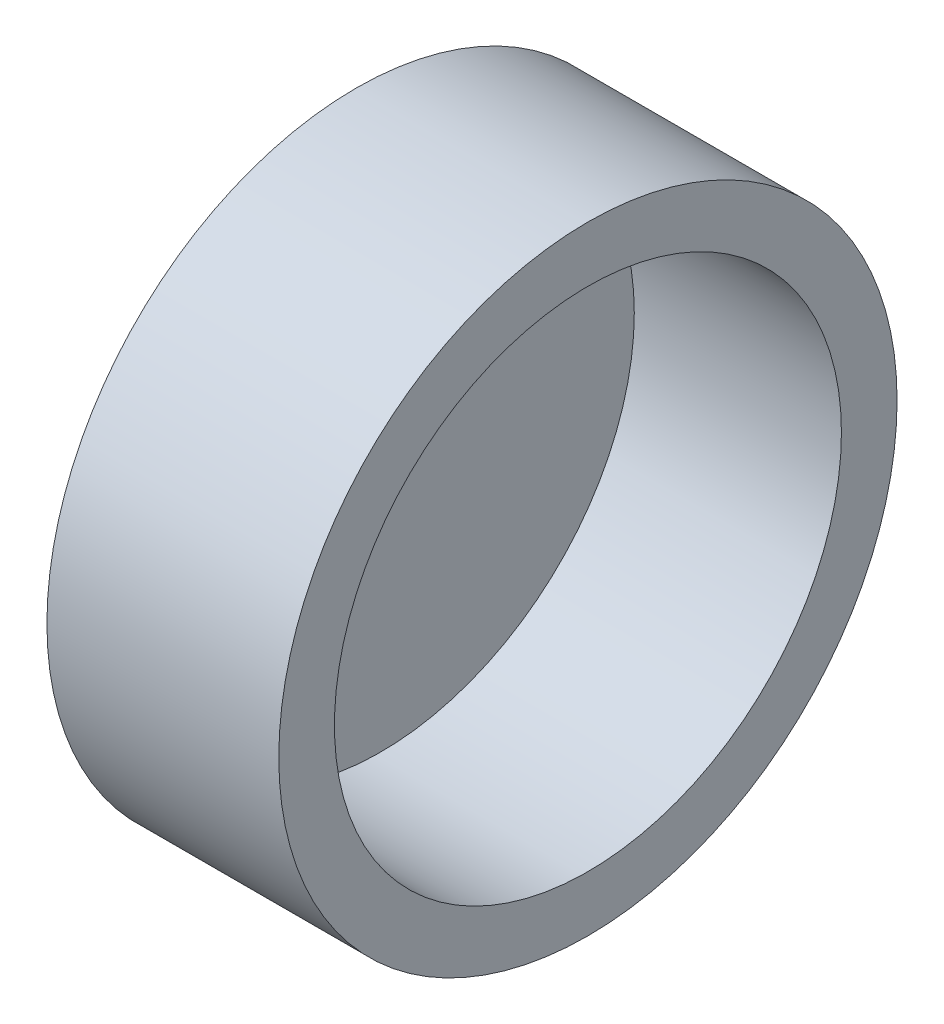
from build123d import *

# Parameters (mm, degrees)
SKETCH1_R                    = 164
ROTOR_VOLUME_EXTRUDE_DEPTH   = 16
SKETCH2_R                    = 200
SKETCH2_R_2                  = 164
DUCT_PACKAGING_EXTRUDE_DEPTH = 150


with BuildPart() as part:
    # Sketch1 → Rotor_Volume_Extrude (new, symmetric)
    with BuildSketch(Plane(origin=(0, 0, 0), x_dir=(0, 0, -1), z_dir=(1, 0, 0))):
        Circle(SKETCH1_R)
    extrude(amount=ROTOR_VOLUME_EXTRUDE_DEPTH, both=True)


with BuildPart() as body_2:
    # Sketch2 → Duct_Packaging_Extrude (new body)
    with BuildSketch(Plane(origin=(0, 0, 0), x_dir=(0, 0, -1), z_dir=(1, 0, 0))):
        Circle(SKETCH2_R)
        Circle(SKETCH2_R_2, mode=Mode.SUBTRACT)
    extrude(amount=DUCT_PACKAGING_EXTRUDE_DEPTH)


solid = Compound([part.part, body_2.part])
